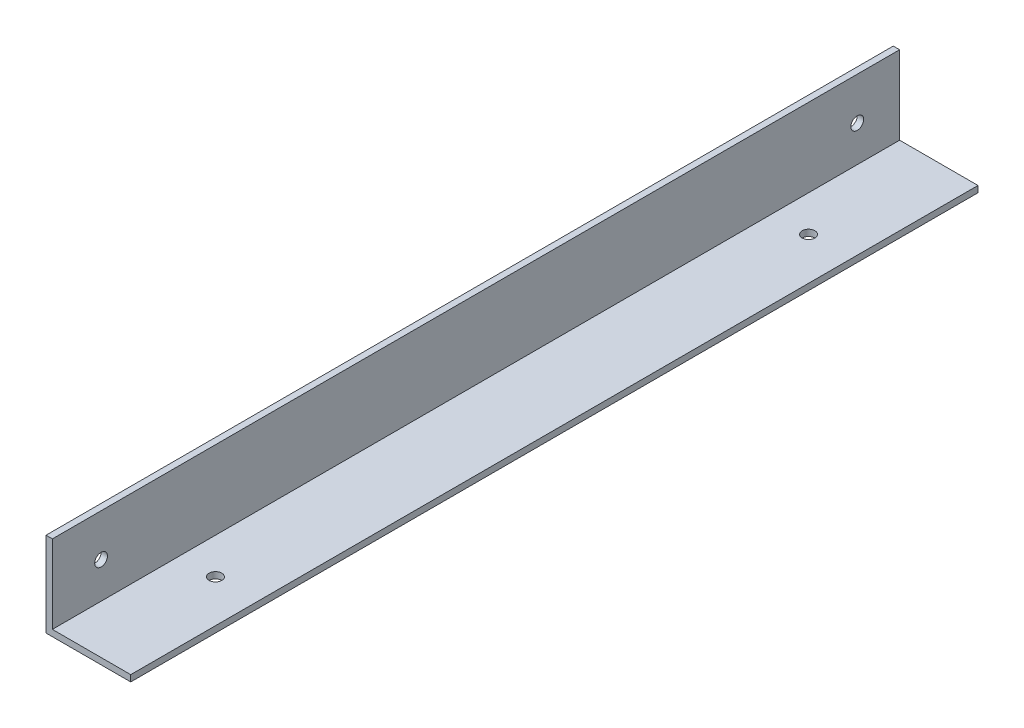
from build123d import *

# Parameters (mm, degrees)
EXTRUSION1_DEPTH = 200
ESQUISSE3_R      = 1.5
EXTRUSION3_DEPTH = 150
ESQUISSE2_R      = 1.5
EXTRUSION4_DEPTH = 100


with BuildPart() as part:
    # Esquisse1 → Extrusion1 (new body)
    with BuildSketch(Plane.XY):
        Polygon((-18.113475854, 1.818947368), (-18.113475854, -18.181052632), (1.886524146, -18.181052632), (1.886524146, -16.681052632), (-16.613475854, -16.681052632), (-16.613475854, 1.818947368), align=None)
    extrude(amount=EXTRUSION1_DEPTH)

    # Esquisse3 → Extrusion3 (cut)
    with BuildSketch(Plane(origin=(-16.613475854, 0, 0), x_dir=(0, 0, -1), z_dir=(1, 0, 0))):
        with Locations((-10, -8.181052632)):
            Circle(ESQUISSE3_R)
        with Locations((-188.5, -8.181052632)):
            Circle(ESQUISSE3_R)
    extrude(amount=-EXTRUSION3_DEPTH, mode=Mode.SUBTRACT)

    # Esquisse2 → Extrusion4 (cut)
    with BuildSketch(Plane(origin=(0, -16.681052632, 0), x_dir=(-1, 0, 0), z_dir=(0, 1, 0))):
        with Locations((8.113475854, 170)):
            Circle(ESQUISSE2_R)
        with Locations((8.113475854, 30)):
            Circle(ESQUISSE2_R)
    extrude(amount=-EXTRUSION4_DEPTH, mode=Mode.SUBTRACT)


solid = part.part
